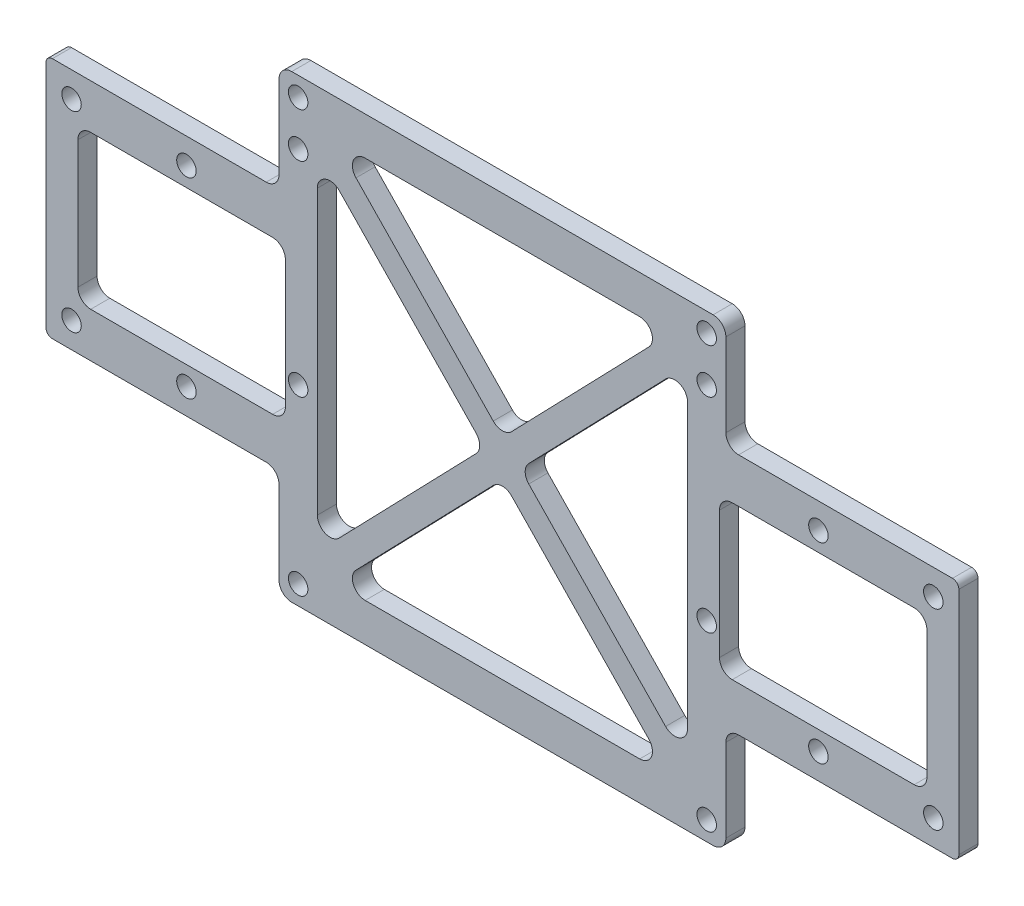
from build123d import *

# Parameters (mm, degrees)
SKETCH_1_W          = 143
SKETCH_1_H          = 38
SKETCH_1_R          = 1.525
EXTRUDE_1_DEPTH     = 3
SKETCH_2_R          = 1.525
CUT_EXTRUDE_1_DEPTH = 3
FILLET_1_R          = 1
SKETCH_3_W          = 70
SKETCH_3_H          = 72
SKETCH_3_R          = 1.525
EXTRUDE_2_DEPTH     = 3
FILLET_2_R          = 2
SKETCH_4_R          = 1.525
CUT_EXTRUDE_2_DEPTH = 3
CUT_EXTRUDE_3_DEPTH = 3
FILLET_3_R          = 2
SKETCH_6_R          = 1.525
CUT_EXTRUDE_4_DEPTH = 3
SKETCH_7_W          = 32.5
SKETCH_7_H          = 24
CUT_EXTRUDE_5_DEPTH = 3
FILLET_4_R          = 2


with BuildPart() as part:
    # 草图1 → 凸台-拉伸1 (new body)
    with BuildSketch(Plane.XY):
        Rectangle(SKETCH_1_W, SKETCH_1_H)
        with Locations((67.5, 15)):
            Circle(SKETCH_1_R, mode=Mode.SUBTRACT)
        with Locations((67.5, -15)):
            Circle(SKETCH_1_R, mode=Mode.SUBTRACT)
        with Locations((-67.5, 15)):
            Circle(SKETCH_1_R, mode=Mode.SUBTRACT)
        with Locations((-67.5, -15)):
            Circle(SKETCH_1_R, mode=Mode.SUBTRACT)
    extrude(amount=EXTRUDE_1_DEPTH)

    # 草图2 → 切除-拉伸1 (cut)
    with BuildSketch(Plane.XY.offset(3)):
        with Locations((-32, 26)):
            Circle(SKETCH_2_R)
        with Locations((-32, -6)):
            Circle(SKETCH_2_R)
        with Locations((32, 26)):
            Circle(SKETCH_2_R)
        with Locations((32, -6)):
            Circle(SKETCH_2_R)
    extrude(amount=-CUT_EXTRUDE_1_DEPTH, mode=Mode.SUBTRACT)

    # 圆角1
    fillet_1_edges = [part.edges().sort_by_distance(p)[0] for p in [
        (71.5, -19, 1.5),
        (-71.5, -19, 1.5),
        (-71.5, 19, 1.5),
        (71.5, 19, 1.5),
    ]]
    fillet(fillet_1_edges, radius=FILLET_1_R)

    # 草图3 → 凸台-拉伸2 (add)
    with BuildSketch(Plane.XY.offset(3)):
        Rectangle(SKETCH_3_W, SKETCH_3_H)
        with Locations((-32, 26)):
            Circle(SKETCH_3_R, mode=Mode.SUBTRACT)
        with Locations((-32, -6)):
            Circle(SKETCH_3_R, mode=Mode.SUBTRACT)
        with Locations((32, -6)):
            Circle(SKETCH_3_R, mode=Mode.SUBTRACT)
        with Locations((32, 26)):
            Circle(SKETCH_3_R, mode=Mode.SUBTRACT)
    extrude(amount=-EXTRUDE_2_DEPTH)

    # 圆角2
    fillet_2_edges = [part.edges().sort_by_distance(p)[0] for p in [
        (-35, -19, 1.5),
        (35, -19, 1.5),
        (35, 36, 1.5),
        (-35, -36, 1.5),
        (35, 19, 1.5),
        (35, -36, 1.5),
        (-35, 19, 1.5),
        (-35, 36, 1.5),
    ]]
    fillet(fillet_2_edges, radius=FILLET_2_R)

    # 草图4 → 切除-拉伸2 (cut)
    with BuildSketch(Plane.XY.offset(3)):
        with Locations((32, 33)):
            Circle(SKETCH_4_R)
        with Locations((-32, 33)):
            Circle(SKETCH_4_R)
        with Locations((-32, -33)):
            Circle(SKETCH_4_R)
        with Locations((32, -33)):
            Circle(SKETCH_4_R)
    extrude(amount=-CUT_EXTRUDE_2_DEPTH, mode=Mode.SUBTRACT)

    # 草图5 → 切除-拉伸3 (cut)
    with BuildSketch(Plane.XY.offset(3)):
        Polygon((26.218313861, -30), (0, -2.877606351), (-26.218313861, -30), align=None)
        Polygon((2.781686139, 0), (29, -27.122393649), (29, 27.122393649), align=None)
        Polygon((-29, -27.122393649), (-2.781686139, 0), (-29, 27.122393649), align=None)
        Polygon((-26.218313861, 30), (0, 2.877606351), (26.218313861, 30), align=None)
    extrude(amount=-CUT_EXTRUDE_3_DEPTH, mode=Mode.SUBTRACT)

    # 圆角3
    fillet_3_edges = [part.edges().sort_by_distance(p)[0] for p in [
        (2.781686139, 0, 1.5),
        (29, -27.122393649, 1.5),
        (29, 27.122393649, 1.5),
        (-29, 27.122393649, 1.5),
        (-29, -27.122393649, 1.5),
        (-2.781686139, 0, 1.5),
        (-26.218313861, 30, 1.5),
        (0, 2.877606351, 1.5),
        (26.218313861, 30, 1.5),
        (-26.218313861, -30, 1.5),
        (26.218313861, -30, 1.5),
        (0, -2.877606351, 1.5),
    ]]
    fillet(fillet_3_edges, radius=FILLET_3_R)

    # 草图6 → 切除-拉伸4 (cut)
    with BuildSketch(Plane(origin=(0, 0, 0), x_dir=(-1, 0, 0), z_dir=(0, 0, -1))):
        with Locations((-49.5, 15)):
            Circle(SKETCH_6_R)
        with Locations((-49.5, -15)):
            Circle(SKETCH_6_R)
    cut_extrude_4 = extrude(amount=-CUT_EXTRUDE_4_DEPTH, mode=Mode.SUBTRACT)

    # 镜向1: 切除-拉伸4 across plane
    add(cut_extrude_4.mirror(Plane(origin=(0, 0, 0), x_dir=(0, 0, 1), z_dir=(1, 0, 0))), mode=Mode.SUBTRACT)

    # 草图7 → 切除-拉伸5 (cut)
    with BuildSketch(Plane(origin=(0, 0, 0), x_dir=(-1, 0, 0), z_dir=(0, 0, -1))):
        with Locations((-50.25, 0)):
            Rectangle(SKETCH_7_W, SKETCH_7_H)
    cut_extrude_5 = extrude(amount=-CUT_EXTRUDE_5_DEPTH, mode=Mode.SUBTRACT)

    # 镜向2: 切除-拉伸5 across plane
    add(cut_extrude_5.mirror(Plane(origin=(0, 0, 0), x_dir=(0, 0, 1), z_dir=(1, 0, 0))), mode=Mode.SUBTRACT)

    # 圆角4
    fillet_4_edges = [part.edges().sort_by_distance(p)[0] for p in [
        (34, 12, 1.5),
        (34, -12, 1.5),
        (66.5, -12, 1.5),
        (66.5, 12, 1.5),
        (-66.5, -12, 1.5),
        (-66.5, 12, 1.5),
        (-34, 12, 1.5),
        (-34, -12, 1.5),
    ]]
    fillet(fillet_4_edges, radius=FILLET_4_R)


solid = part.part
